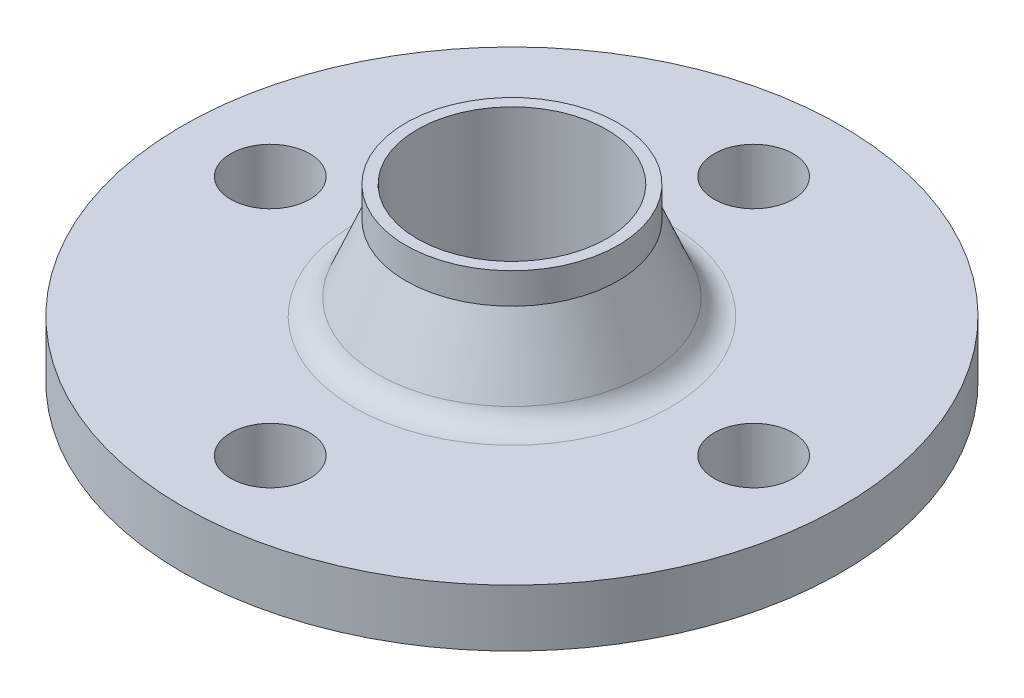
from build123d import *

# Parameters (mm, degrees)
SZKIC1_W                    = 75
SZKIC1_H                    = 13
SZKIC2_R                    = 32
DODANIE_WYCI_GNI_CIE1_DEPTH = 19
DODANIE_WYCI_GNI_CIE1_TAPER = 22.448353305
SZKIC3_R                    = 24.15
DODANIE_WYCI_GNI_CIE2_DEPTH = 7
SZKIC4_R                    = 47
DODANIE_WYCI_GNI_CIE3_DEPTH = 3
DODANIE_WYCI_GNI_CIE3_TAPER = 45
OTW_R_18_0_18_1_D           = 18
OTW_R_18_0_18_1_DEPTH       = 13
OTW_R_POD_RUB_M391_D        = 43.1
ZAOKR_GLENIE1_R             = 6


with BuildPart() as part:
    # Szkic1 → Obrót1 (revolve)
    with BuildSketch(Plane(origin=(0, 0, 0), x_dir=(-1, 0, 0), z_dir=(0, 0, -1)), mode=Mode.PRIVATE) as obr_t1_sk:
        with Locations((-37.5, 9.5)):
            Rectangle(SZKIC1_W, SZKIC1_H)
    revolve(obr_t1_sk.sketch.rotate(Axis((0, 3, 0), (0, 1, 0)), 270), axis=Axis((0, 3, 0), (0, 1, 0)))

    # Szkic2 → Dodanie-wyciągnięcie1 (add)
    with BuildSketch(Plane(origin=(0, 16, 0), x_dir=(-1, 0, 0), z_dir=(0, 1, 0))):
        Circle(SZKIC2_R)
    extrude(amount=DODANIE_WYCI_GNI_CIE1_DEPTH, taper=DODANIE_WYCI_GNI_CIE1_TAPER)

    # Szkic3 → Dodanie-wyciągnięcie2 (add)
    with BuildSketch(Plane(origin=(0, 35, 0), x_dir=(-1, 0, 0), z_dir=(0, 1, 0))):
        with Locations(Location((0, 0, 0), (0, 0, 270))):
            Circle(SZKIC3_R)
    extrude(amount=DODANIE_WYCI_GNI_CIE2_DEPTH)

    # Szkic4 → Dodanie-wyciągnięcie3 (add)
    with BuildSketch(Plane.XZ.offset(-3)):
        Circle(SZKIC4_R)
    extrude(amount=DODANIE_WYCI_GNI_CIE3_DEPTH, taper=DODANIE_WYCI_GNI_CIE3_TAPER)

    # Otwór Ø18.0 (18)1
    with Locations(Plane(origin=(0, 16, 0), x_dir=(1, 0, 0), z_dir=(0, 1, 0))):
        with Locations((-55, 0), (55, 0), (0, -55), (0, 55)):
            Hole(OTW_R_18_0_18_1_D / 2, depth=OTW_R_18_0_18_1_DEPTH)

    # Otwór pod śrubę M391 (through all)
    with Locations(Plane(origin=(0, 42, 0), x_dir=(1, 0, 0), z_dir=(0, 1, 0))):
        with Locations((0, 0)):
            Hole(OTW_R_POD_RUB_M391_D / 2)

    # Zaokrąglenie1
    zaokr_glenie1_edges = [part.edges().sort_by_distance(p)[0] for p in [
        (32, 16, 0),
    ]]
    fillet(zaokr_glenie1_edges, radius=ZAOKR_GLENIE1_R)


solid = part.part
